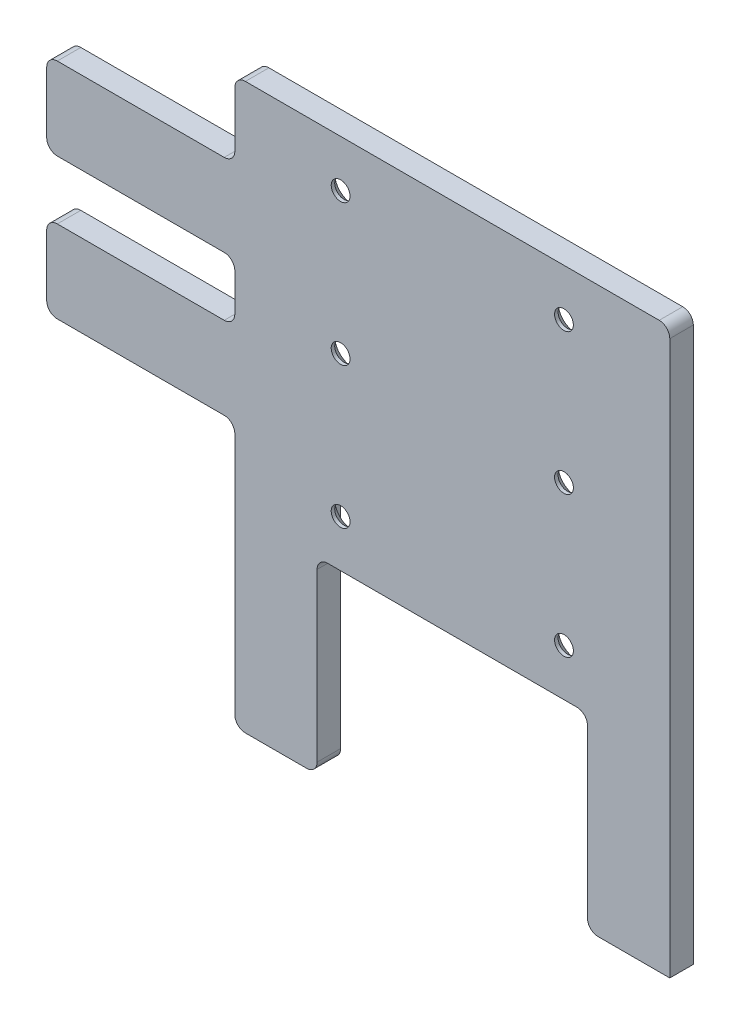
from build123d import *

# Parameters (mm, degrees)
SKETCH_1_W      = 32
SKETCH_1_H      = 14
SKETCH_1_W_2    = 74
SKETCH_1_H_2    = 64
SKETCH_1_R      = 1.6
SKETCH_1_W_3    = 14
SKETCH_1_H_3    = 32
EXTRUDE_1_DEPTH = 2
CHAMFER_1_SIZE  = 1.4
SKETCH_2_W      = 10.4
SKETCH_2_H      = 43.2
SKETCH_2_W_2    = 102.4
SKETCH_2_H_2    = 10.4
SKETCH_2_W_3    = 70.4
SKETCH_2_H_3    = 10
SKETCH_2_H_4    = 11.2
EXTRUDE_2_DEPTH = 2
FILLET_1_R      = 1.8


with BuildPart() as part:
    # 草图1 → 凸台-拉伸1 (new body)
    # profile 1 of 5: a face of its own
    with BuildSketch(Plane.XY):
        with Locations((-34, 12)):
            Rectangle(SKETCH_1_W, SKETCH_1_H)
    # profile 2 of 5: a face of its own
    with BuildSketch(Plane.XY):
        with Locations((-34, 36)):
            Rectangle(SKETCH_1_W, SKETCH_1_H)
    # profile 3 of 5: a face of its own
    with BuildSketch(Plane.XY):
        with Locations((19, 24)):
            Rectangle(SKETCH_1_W_2, SKETCH_1_H_2)
        with Locations((0, 48)):
            Circle(SKETCH_1_R, mode=Mode.SUBTRACT)
        with Locations((0, 24)):
            Circle(SKETCH_1_R, mode=Mode.SUBTRACT)
        with Locations((38, 48)):
            Circle(SKETCH_1_R, mode=Mode.SUBTRACT)
        with Locations((38, 24)):
            Circle(SKETCH_1_R, mode=Mode.SUBTRACT)
        with Locations((38, 0)):
            Circle(SKETCH_1_R, mode=Mode.SUBTRACT)
        Circle(SKETCH_1_R, mode=Mode.SUBTRACT)
    # profile 4 of 5: a face of its own
    with BuildSketch(Plane.XY):
        with Locations((-11, -24)):
            Rectangle(SKETCH_1_W_3, SKETCH_1_H_3)
    # profile 5 of 5: a face of its own
    with BuildSketch(Plane.XY):
        with Locations((49, -24)):
            Rectangle(SKETCH_1_W_3, SKETCH_1_H_3)
    extrude(amount=EXTRUDE_1_DEPTH)

    # 倒角1
    chamfer_1_edges = [part.edges().sort_by_distance(p)[0] for p in [
        (-1.6, 0, 0),
        (36.4, 0, 0),
        (36.4, 24, 0),
        (36.4, 48, 0),
        (-1.6, 24, 0),
        (-1.6, 48, 0),
    ]]
    chamfer(chamfer_1_edges, length=CHAMFER_1_SIZE)

    # 草图2 → 凸台-拉伸2 (add)
    with BuildSketch(Plane(origin=(0, 0, 0), x_dir=(-1, 0, 0), z_dir=(0, 0, -1))):
        Polygon((-56, 56), (-56, -40), (-42, -40), (-42, 5), (4, 5), (4, -40), (18, -40), (18, 5), (50, 5), (50, 19), (18, 19), (18, 29), (50, 29), (50, 43), (18, 43), (18, 56), align=None)
        with Locations((11, -16.6)):
            Rectangle(SKETCH_2_W, SKETCH_2_H, mode=Mode.SUBTRACT)
        with Locations((-49, -16.6)):
            Rectangle(SKETCH_2_W, SKETCH_2_H, mode=Mode.SUBTRACT)
        with Locations((-3, 12)):
            Rectangle(SKETCH_2_W_2, SKETCH_2_H_2, mode=Mode.SUBTRACT)
        with Locations((-19, 24)):
            Rectangle(SKETCH_2_W_3, SKETCH_2_H_3, mode=Mode.SUBTRACT)
        with Locations((-3, 36)):
            Rectangle(SKETCH_2_W_2, SKETCH_2_H_2, mode=Mode.SUBTRACT)
        with Locations((-19, 48.6)):
            Rectangle(SKETCH_2_W_3, SKETCH_2_H_4, mode=Mode.SUBTRACT)
    extrude(amount=EXTRUDE_2_DEPTH)

    # 圆角1
    fillet_1_edges = [part.edges().sort_by_distance(p)[0] for p in [
        (-18, 19, 0),
        (-18, 29, 0),
        (-50, 29, 0),
        (-50, 43, 0),
        (-18, 43, 0),
        (-18, 56, 0),
        (56, 56, 0),
        (42, -40, 0),
        (42, -8, 1),
        (-4, -8, 1),
        (-4, -40, 0),
        (-18, -40, 0),
        (-18, 5, 0),
        (-50, 5, 0),
        (-50, 19, 0),
    ]]
    fillet(fillet_1_edges, radius=FILLET_1_R)


solid = part.part
